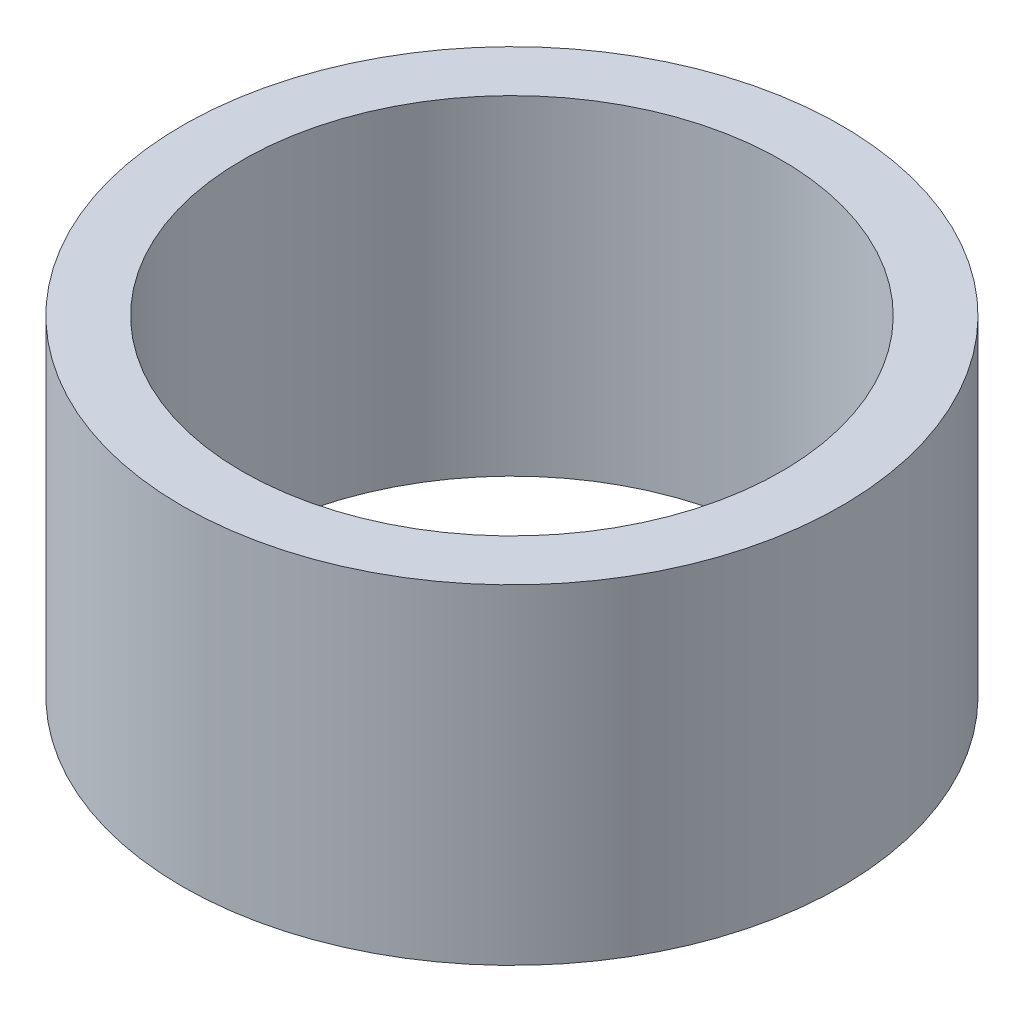
from build123d import *

# Parameters (mm, degrees)
SKETCH1_R           = 11
SKETCH1_R_2         = 9
BOSS_EXTRUDE1_DEPTH = 11


with BuildPart() as part:
    # Sketch1 → Boss-Extrude1 (new body)
    with BuildSketch(Plane(origin=(0, 0, 0), x_dir=(1, 0, 0), z_dir=(0, 1, 0))):
        with Locations(Location((0, 0, 0), (0, 0, 270))):
            Circle(SKETCH1_R)
        with Locations(Location((0, 0, 0), (0, 0, 270))):
            Circle(SKETCH1_R_2, mode=Mode.SUBTRACT)
    extrude(amount=BOSS_EXTRUDE1_DEPTH)


solid = part.part
